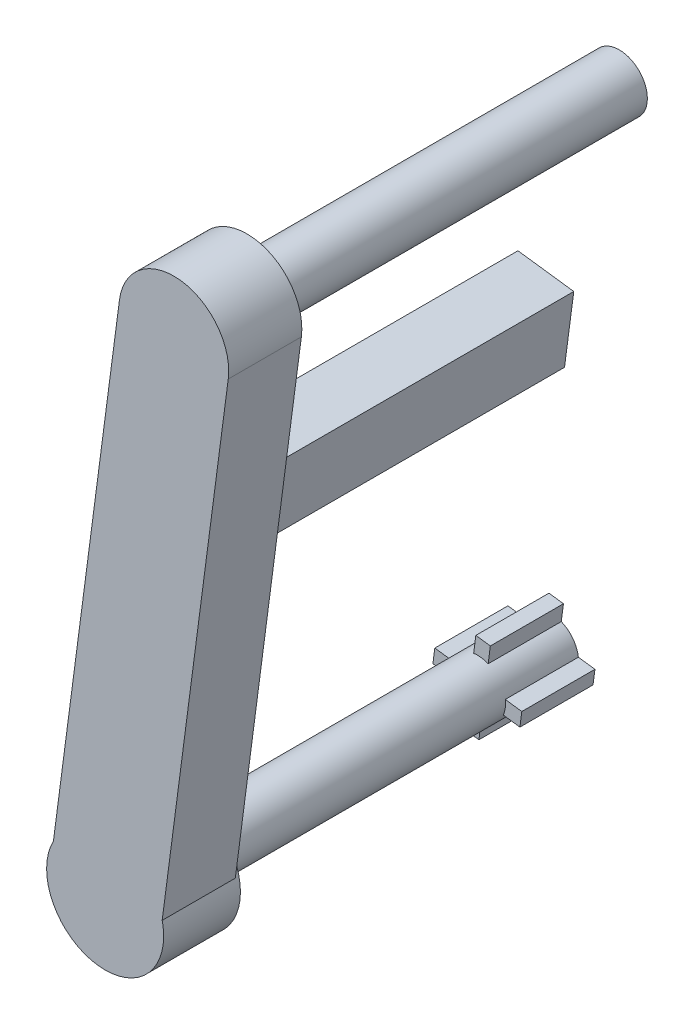
from build123d import *

# Parameters (mm, degrees)
SKETCH1_R           = 8
BOSS_EXTRUDE1_DEPTH = 10.5
SKETCH2_R           = 3.85
BOSS_EXTRUDE2_DEPTH = 60
BOSS_EXTRUDE3_START = -9.6
BOSS_EXTRUDE3_DEPTH = 10
CUT_EXTRUDE1_START  = -9.6
SKETCH6_R           = 3.85
CUT_EXTRUDE1_DEPTH  = 9.6
BOSS_EXTRUDE4_DEPTH = 10
SKETCH8_R           = 4.5
BOSS_EXTRUDE5_DEPTH = 0.5
SKETCH9_R           = 3.85
BOSS_EXTRUDE6_DEPTH = 50.4
BOSS_EXTRUDE7_DEPTH = 43.5
SKETCH12_R          = 1.75
CUT_EXTRUDE2_DEPTH  = 10


with BuildPart() as part:
    # Sketch1 → Boss-Extrude1 (new body)
    with BuildSketch(Plane.XY):
        Circle(SKETCH1_R)
    extrude(amount=-BOSS_EXTRUDE1_DEPTH)

    # Sketch2 → Boss-Extrude2 (add)
    with BuildSketch(Plane(origin=(0, 0, -10.5), x_dir=(-1, 0, 0), z_dir=(0, 0, -1))):
        Circle(SKETCH2_R)
    extrude(amount=BOSS_EXTRUDE2_DEPTH)

    # Sketch3 → Boss-Extrude3 (add)
    with BuildSketch(Plane(origin=(0, 0, -70.5), x_dir=(-1, 0, 0), z_dir=(0, 0, -1)).offset(BOSS_EXTRUDE3_START)):
        Polygon((-6.07919536, 0.208287708), (-1.121971054, 0.860918669), (-1.774602015, 5.818142976), (0.208287708, 6.07919536), (0.860918669, 1.121971054), (5.818142976, 1.774602015), (6.07919536, -0.208287708), (1.121971054, -0.860918669), (1.774602015, -5.818142976), (-0.208287708, -6.07919536), (-0.860918669, -1.121971054), (-5.818142976, -1.774602015), align=None)
    extrude(amount=-BOSS_EXTRUDE3_DEPTH)

    # Sketch6 → Cut-Extrude1 (cut)
    with BuildSketch(Plane(origin=(0, 0, -70.5), x_dir=(-1, 0, 0), z_dir=(0, 0, -1)).offset(CUT_EXTRUDE1_START)):
        with Locations(Location((0, 0, 0), (0, 0, 172.44534936))):
            Circle(SKETCH6_R)
    extrude(amount=CUT_EXTRUDE1_DEPTH, mode=Mode.SUBTRACT)

    # Sketch7 → Boss-Extrude4 (add)
    with BuildSketch(Plane.XY):
        with BuildLine():
            Line((1.96204938, 72.362976461), (-7.07246692, 3.739012125))
            Line((-7.07246692, 3.739012125), (7.799206001, 1.781119242))
            Line((7.799206001, 1.781119242), (16.8337223, 70.405083577))
            ThreePointArc((16.8337223, 70.405083577), (10.376832281, 78.819866479), (1.96204938, 72.362976461))
        make_face()
    extrude(amount=-BOSS_EXTRUDE4_DEPTH)

    # Sketch8 → Boss-Extrude5 (add)
    with BuildSketch(Plane(origin=(0, 0, -10), x_dir=(-1, 0, 0), z_dir=(0, 0, -1))):
        with Locations(Location((-9.39788584, 71.384030019, 0), (0, 0, 180))):
            Circle(SKETCH8_R)
    extrude(amount=BOSS_EXTRUDE5_DEPTH)

    # Sketch9 → Boss-Extrude6 (add)
    with BuildSketch(Plane(origin=(0, 0, -10.5), x_dir=(-1, 0, 0), z_dir=(0, 0, -1))):
        with Locations(Location((-9.39788584, 71.384030019, 0), (0, 0, 180))):
            Circle(SKETCH9_R)
    extrude(amount=BOSS_EXTRUDE6_DEPTH)

    # Sketch11 → Boss-Extrude7 (add)
    with BuildSketch(Plane(origin=(0, 0, -10), x_dir=(-1, 0, 0), z_dir=(0, 0, -1))):
        Polygon((-2.951315217, 51.908863587), (-10.584845783, 50.903890222), (-9.318741718, 41.286875067), (-1.685211153, 42.291848431), align=None)
    extrude(amount=BOSS_EXTRUDE7_DEPTH)

    # Sketch12 → Cut-Extrude2 (cut)
    with BuildSketch(Plane(origin=(0, 0, -53.5), x_dir=(-1, 0, 0), z_dir=(0, 0, -1))):
        with Locations(Location((-6.135028468, 46.597869327, 0), (0, 0, 90))):
            Circle(SKETCH12_R)
    extrude(amount=-CUT_EXTRUDE2_DEPTH, mode=Mode.SUBTRACT)


solid = part.part
